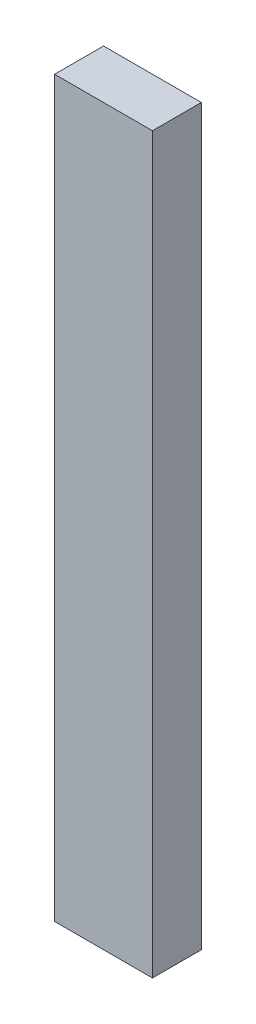
from build123d import *

# Parameters (mm, degrees)
SKETCH1_W           = 20
SKETCH1_H           = 10
BOSS_EXTRUDE1_DEPTH = 150


with BuildPart() as part:
    # Sketch1 → Boss-Extrude1 (new body)
    with BuildSketch(Plane(origin=(0, 0, 0), x_dir=(1, 0, 0), z_dir=(0, 1, 0))):
        Rectangle(SKETCH1_W, SKETCH1_H)
    extrude(amount=BOSS_EXTRUDE1_DEPTH)


solid = part.part
